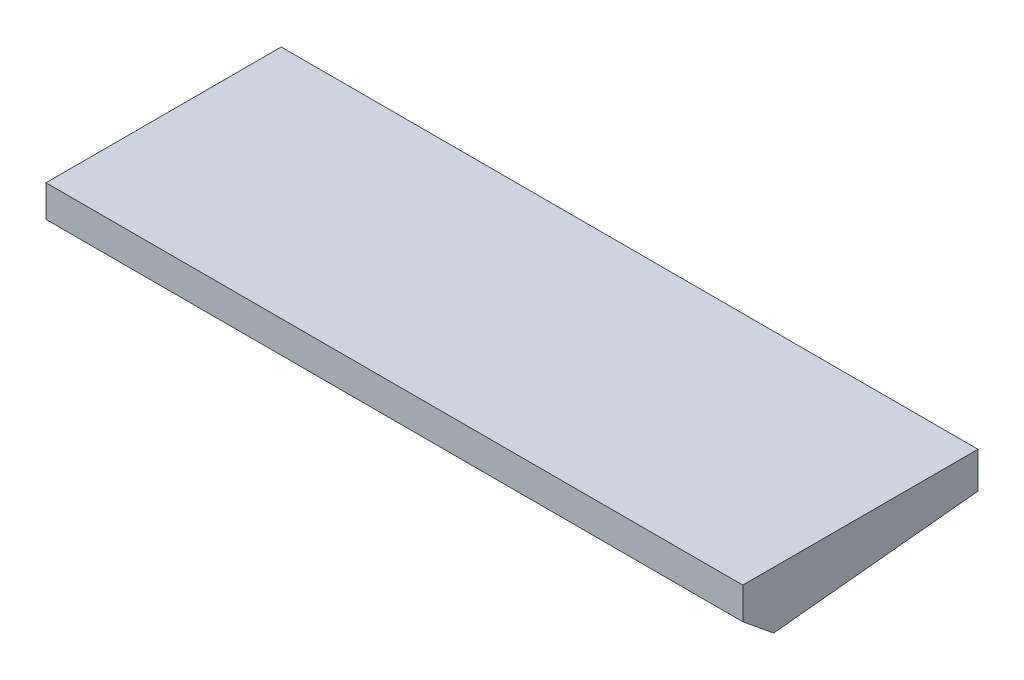
from build123d import *

# Parameters (mm, degrees)
BOSS_EXTRUDE1_DEPTH = 390.2


with BuildPart() as part:
    # Sketch2 → Boss-Extrude1 (new body)
    with BuildSketch(Plane(origin=(0, 0, 0), x_dir=(0, 0, -1), z_dir=(1, 0, 0))):
        Polygon((-131.7, 31.903388491), (-131.7, 14.103388491), (-114.413117148, 0), (0, 11.603388491), (0, 31.903388491), align=None)
    extrude(amount=BOSS_EXTRUDE1_DEPTH)


solid = part.part
